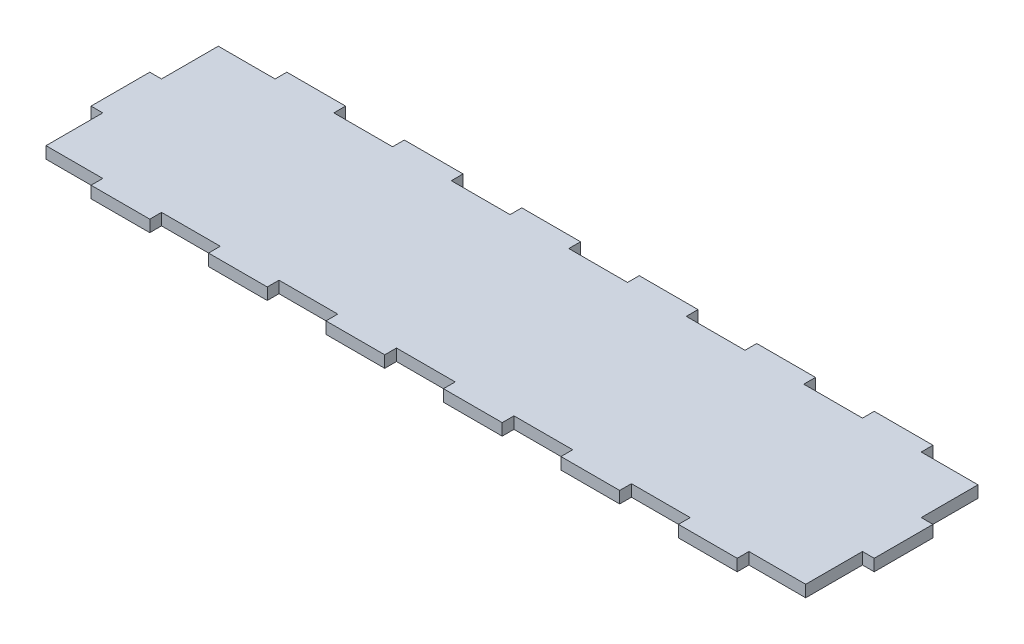
from build123d import *

# Parameters (mm, degrees)
SALIENTE_EXTRUIR1_DEPTH = 3


with BuildPart() as part:
    # Croquis1 → Saliente-Extruir1 (new body)
    with BuildSketch(Plane(origin=(0, 0, 0), x_dir=(1, 0, 0), z_dir=(0, 1, 0))):
        Polygon((200, 17.5), (200, 32.5), (197, 32.5), (197, 47), (182.5, 47), (182.5, 50), (167.5, 50), (167.5, 47), (152.5, 47), (152.5, 50), (137.5, 50), (137.5, 47), (122.5, 47), (122.5, 50), (107.5, 50), (107.5, 47), (92.5, 47), (92.5, 50), (77.5, 50), (77.5, 47), (62.5, 47), (62.5, 50), (47.5, 50), (47.5, 47), (32.5, 47), (32.5, 50), (17.5, 50), (17.5, 47), (3, 47), (3, 32.5), (0, 32.5), (0, 17.5), (3, 17.5), (3, 3), (17.5, 3), (17.5, 0), (32.5, 0), (32.5, 3), (47.5, 3), (47.5, 0), (62.5, 0), (62.5, 3), (77.5, 3), (77.5, 0), (92.5, 0), (92.5, 3), (107.5, 3), (107.5, 0), (122.5, 0), (122.5, 3), (137.5, 3), (137.5, 0), (152.5, 0), (152.5, 3), (167.5, 3), (167.5, 0), (182.5, 0), (182.5, 3), (197, 3), (197, 17.5), align=None)
    extrude(amount=SALIENTE_EXTRUIR1_DEPTH)


solid = part.part
